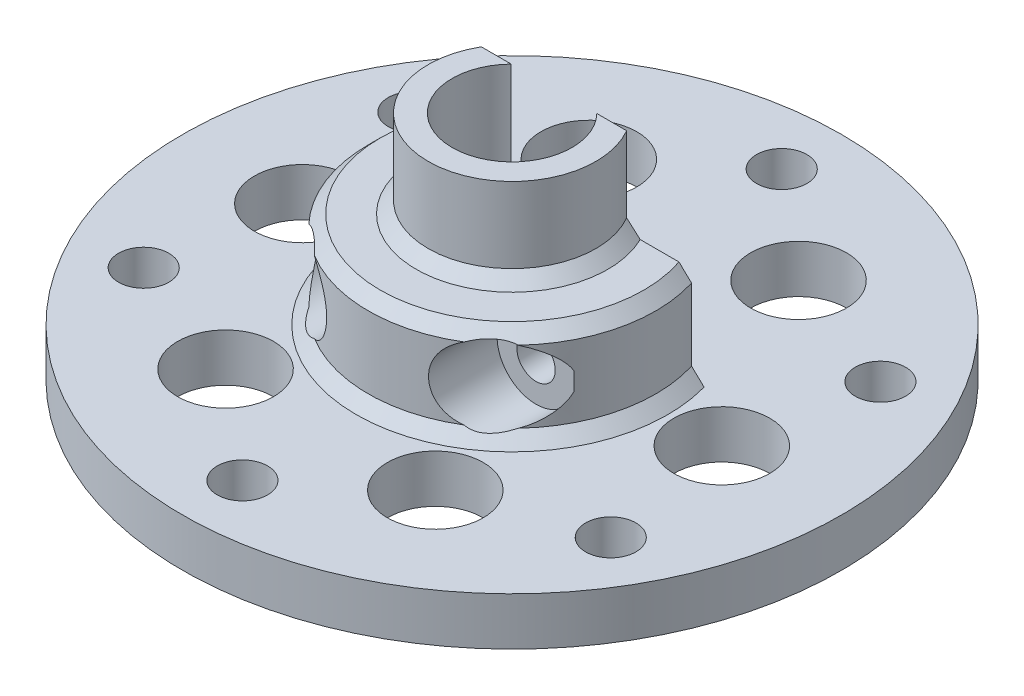
from build123d import *

# Parameters (mm, degrees)
SKETCH_2_R                      = 4
CUT_EXTRUDE_2_DEPTH             = 10
CUT_EXTRUDE_4_REACH             = 42.7
CUT_EXTRUDE_4_DIRECTION_2_DEPTH = 41.70012285
CHAMFER_1_SIZE                  = 1
CUT_EXTRUDE_3_DEPTH             = 44.416471529
CUT_EXTRUDE_3_DEPTH_BACK        = 44.416471529
SKETCH_3_R                      = 1.6
SKETCH_7_R                      = 3.25
CUT_EXTRUDE_5_DEPTH             = 48.092886936
HOLE_WIZARD_M5_1_D              = 4.2


with BuildPart() as part:
    # 草图1 → 旋转1 (revolve)
    with BuildSketch(Plane.XY, mode=Mode.PRIVATE) as revolve_1_sk:
        Polygon((-5, 0), (-27.5, 0), (-27.5, 4), (-12, 4), (-12, 12), (-7, 12), (-7, 19.3), (-5, 19.3), align=None)
    revolve(revolve_1_sk.sketch.rotate(Axis((0, 0, 0), (0, 1, 0)), 270), axis=Axis((0, 0, 0), (0, 1, 0)))

    # 草图2 → 切除-拉伸2 (cut)
    with BuildSketch(Plane.XZ):
        with Locations(Location((-8.75, -15.155444566, 0), (0, 0, 270))):
            Circle(SKETCH_2_R)
        with Locations(Location((-8.75, 15.155444566, 0), (0, 0, 270))):
            Circle(SKETCH_2_R)
        with Locations(Location((8.75, 15.155444566, 0), (0, 0, 270))):
            Circle(SKETCH_2_R)
        with Locations(Location((17.5, 0, 0), (0, 0, 270))):
            Circle(SKETCH_2_R)
        with Locations(Location((8.75, -15.155444566, 0), (0, 0, 270))):
            Circle(SKETCH_2_R)
        with Locations(Location((-17.5, 0, 0), (0, 0, 270))):
            Circle(SKETCH_2_R)
    extrude(amount=-CUT_EXTRUDE_2_DEPTH, mode=Mode.SUBTRACT)

    # 切除-拉伸4: up to this face of the body (flat: up to its plane)
    cut_extrude_4_end = Plane(part.part.faces().sort_by_distance((0, 4, 26.722182541))[0])
    # 草图6 → 切除-拉伸4 (cut, up to the picked face)
    with BuildSketch(Plane.XZ.offset(-12), mode=Mode.PRIVATE) as cut_extrude_4_sk1:
        with BuildLine():
            Line((11.478240283, -3.5), (-11.478240283, -3.5))
            ThreePointArc((-11.478240283, -3.5), (0, -12), (11.478240283, -3.5))
        make_face()
    cut_extrude_4_tool1 = split(extrude(cut_extrude_4_sk1.sketch, amount=CUT_EXTRUDE_4_REACH, mode=Mode.PRIVATE), bisect_by=cut_extrude_4_end, keep=Keep.BOTH, mode=Mode.PRIVATE)
    add(cut_extrude_4_tool1.solids().sort_by(Axis((0, 12, -7.030424), (0, -1, 0)))[0], mode=Mode.SUBTRACT)

    # 草图6 → 切除-拉伸4 direction 2 (cut)
    with BuildSketch(Plane.XZ.offset(-12)):
        with BuildLine():
            Line((11.478240283, -3.5), (-11.478240283, -3.5))
            ThreePointArc((-11.478240283, -3.5), (0, -12), (11.478240283, -3.5))
        make_face()
    extrude(amount=-CUT_EXTRUDE_4_DIRECTION_2_DEPTH, mode=Mode.SUBTRACT)

    # 倒角1
    chamfer_1_edges = [part.edges().sort_by_distance(p)[0] for p in [
        (0, 12, 7),
        (0, 12, 12),
        (0, 4, 12),
        (0, 0, 5),
    ]]
    chamfer(chamfer_1_edges, length=CHAMFER_1_SIZE)

    # 草图3 → 切除-拉伸3 (cut, two sides: drawn at the far end of the back side and taken through both)
    with BuildSketch(Plane.XY.offset(-CUT_EXTRUDE_3_DEPTH_BACK)):
        with Locations((7.5, 8)):
            Circle(SKETCH_3_R)
        with Locations((-7.5, 8)):
            Circle(SKETCH_3_R)
    extrude(amount=CUT_EXTRUDE_3_DEPTH + CUT_EXTRUDE_3_DEPTH_BACK, mode=Mode.SUBTRACT)

    # 草图7 → 切除-拉伸5 (cut, through all)
    with BuildSketch(Plane(origin=(0, 0, 5.5), x_dir=(-1, 0, 0), z_dir=(0, 0, -1))):
        with Locations((-7.5, 8)):
            Circle(SKETCH_7_R)
        with Locations((7.5, 8)):
            Circle(SKETCH_7_R)
    extrude(amount=-CUT_EXTRUDE_5_DEPTH, mode=Mode.SUBTRACT)

    # M5 螺纹孔1 (through all)
    with Locations(Plane(origin=(0, 4, 0), x_dir=(1, 0, 0), z_dir=(0, 1, 0))):
        with Locations((0, 22.5), (19.485571585, 11.25), (19.485571585, -11.25), (0, -22.5), (-19.485571585, -11.25), (-19.485571585, 11.25)):
            Hole(HOLE_WIZARD_M5_1_D / 2)


solid = part.part
